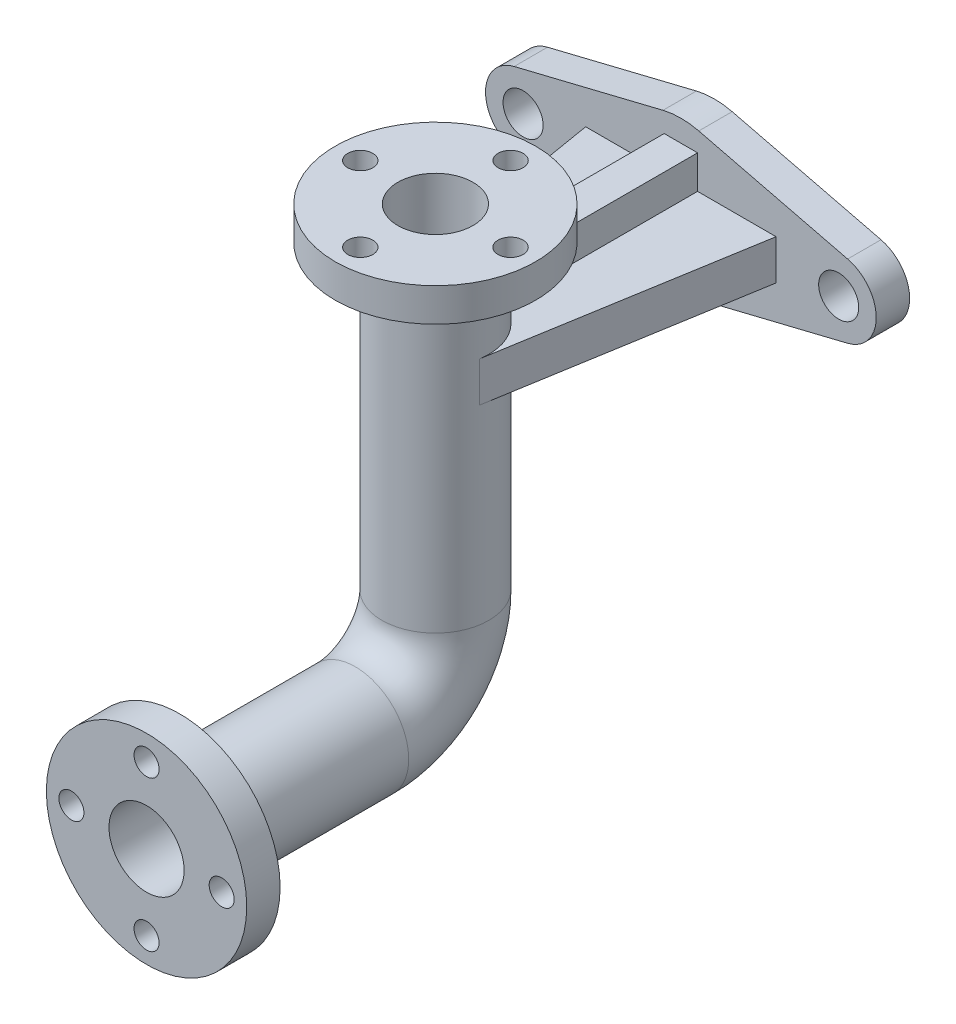
from build123d import *

# Parameters (mm, degrees)
SKETCH1_R           = 32
SKETCH1_R_2         = 22.5
SKETCH4_R           = 60
SKETCH4_R_2         = 22.5
BOSS_EXTRUDE1_DEPTH = 20
BOSS_EXTRUDE2_START = -20
SKETCH5_R           = 60
SKETCH5_R_2         = 22.5
BOSS_EXTRUDE2_DEPTH = 20
HOLE1_D             = 15
HOLE1_DEPTH         = 20
CIRPATTERN1_COUNT   = 4
HOLE2_D             = 15
HOLE2_DEPTH         = 20
CIRPATTERN2_COUNT   = 4
SKETCH10_R          = 12
BOSS_EXTRUDE3_DEPTH = 20
BOSS_EXTRUDE4_DEPTH = 12
SKETCH13_W          = 130
SKETCH13_H          = 64
BOSS_EXTRUDE6_DEPTH = 10


with BuildPart() as part:
    # Sweep1: sweep along a path in Sketch3
    with BuildLine(Plane(origin=(0, 0, 0), x_dir=(0, 0, -1), z_dir=(1, 0, 0))) as sweep1_path:
        Line((0, 0), (125, 0))
        ThreePointArc((125, 0), (158.941125497, 14.058874503), (173, 48))
        Line((173, 48), (173, 248))
    # Sketch1 → Sweep1 (sweep)
    with BuildSketch(Plane.XY):
        Circle(SKETCH1_R)
        Circle(SKETCH1_R_2, mode=Mode.SUBTRACT)
    sweep(path=sweep1_path.line)

    # Sketch4 → Boss-Extrude1 (add)
    with BuildSketch(Plane(origin=(0, 248, 0), x_dir=(1, 0, 0), z_dir=(0, 1, 0))):
        with Locations(Location((0, 173, 0), (0, 0, 270))):
            Circle(SKETCH4_R)
        with Locations((0, 173)):
            Circle(SKETCH4_R_2, mode=Mode.SUBTRACT)
    extrude(amount=-BOSS_EXTRUDE1_DEPTH)

    # Sketch5 → Boss-Extrude2 (add)
    with BuildSketch(Plane.XY.offset(BOSS_EXTRUDE2_START)):
        Circle(SKETCH5_R)
        with Locations(Location((0, 0, 0), (0, 0, 270))):
            Circle(SKETCH5_R_2, mode=Mode.SUBTRACT)
    extrude(amount=BOSS_EXTRUDE2_DEPTH)

    # Hole1
    with Locations(Plane.XY):
        with Locations((45, 0)):
            hole1 = Hole(HOLE1_D / 2, depth=HOLE1_DEPTH)

    # CirPattern1: Hole1 ×4 about axis
    cirpattern1_axis = Axis((0, 0, 0), (0, 0, 1))
    for i in range(1, CIRPATTERN1_COUNT):
        add(hole1.rotate(cirpattern1_axis, i * 360 / CIRPATTERN1_COUNT), mode=Mode.SUBTRACT)

    # Hole2
    with Locations(Plane(origin=(0, 248, 0), x_dir=(1, 0, 0), z_dir=(0, 1, 0))):
        with Locations((45, 173)):
            hole2 = Hole(HOLE2_D / 2, depth=HOLE2_DEPTH)

    # CirPattern2: Hole2 ×4 about axis
    cirpattern2_axis = Axis((0, 0, -173), (0, 1, 0))
    for i in range(1, CIRPATTERN2_COUNT):
        add(hole2.rotate(cirpattern2_axis, i * 360 / CIRPATTERN2_COUNT), mode=Mode.SUBTRACT)



with BuildPart() as body_2:
    # Sketch10 → Boss-Extrude3 (new body)
    with BuildSketch(Plane.XY.offset(-340)):
        with BuildLine():
            Line((-99.857142857, 195.852940773), (-10.714285714, 217.705881545))
            ThreePointArc((-10.714285714, 217.705881545), (0, 219), (10.714285714, 217.705881545))
            Line((10.714285714, 217.705881545), (99.857142857, 195.852940773))
            ThreePointArc((99.857142857, 195.852940773), (117, 174), (99.857142857, 152.147059227))
            Line((99.857142857, 152.147059227), (10.714285714, 130.294118455))
            ThreePointArc((10.714285714, 130.294118455), (0, 129), (-10.714285714, 130.294118455))
            Line((-10.714285714, 130.294118455), (-99.857142857, 152.147059227))
            ThreePointArc((-99.857142857, 152.147059227), (-117, 174), (-99.857142857, 195.852940773))
        make_face()
        with Locations((-94.5, 174)):
            Circle(SKETCH10_R, mode=Mode.SUBTRACT)
        with Locations((94.5, 174)):
            Circle(SKETCH10_R, mode=Mode.SUBTRACT)
    extrude(amount=BOSS_EXTRUDE3_DEPTH)


with BuildPart() as part_1:
    add(part.part)

    add(body_2.part)  # Boss-Extrude4 merges body 2
    # Sketch12 → Boss-Extrude4 (add, symmetric)
    with BuildSketch(Plane(origin=(0, 174, 0), x_dir=(1, 0, 0), z_dir=(0, 1, 0))):
        with BuildLine():
            Line((-31.562633586, 167.727414188), (-57, 320))
            Line((-57, 320), (57, 320))
            Line((57, 320), (31.562633586, 167.727414188))
            ThreePointArc((31.562633586, 167.727414188), (0, 205), (-31.562633586, 167.727414188))
        make_face()
    extrude(amount=BOSS_EXTRUDE4_DEPTH, both=True)

    # Sketch13 → Boss-Extrude6 (add, symmetric)
    with BuildSketch(Plane(origin=(0, 0, 0), x_dir=(0, 0, -1), z_dir=(1, 0, 0))):
        with Locations((261, 174)):
            Rectangle(SKETCH13_W, SKETCH13_H)
    extrude(amount=BOSS_EXTRUDE6_DEPTH, both=True)


solid = part_1.part
